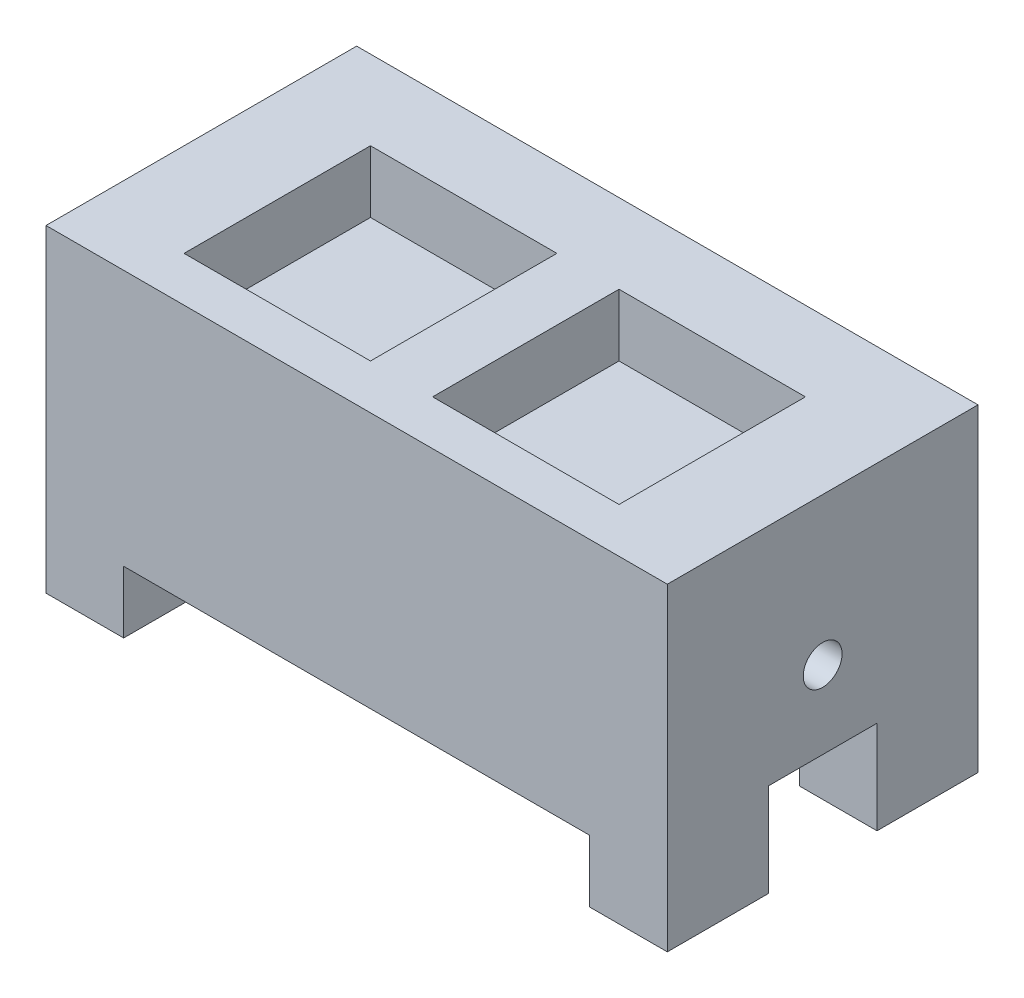
from build123d import *

# Parameters (mm, degrees)
EXTRUDE_1_DEPTH     = 40
SKETCH_2_R          = 2.5
SKETCH_2_W          = 14
SKETCH_2_H          = 12
CUT_EXTRUDE_1_DEPTH = 99.392072851
SKETCH_3_W          = 24
SKETCH_3_H          = 24
CUT_EXTRUDE_2_DEPTH = 8


with BuildPart() as part:
    # Эскиз1 → Бобышка-Вытянуть1 (new body)
    with BuildSketch(Plane.XY):
        Polygon((0, 0), (10, 0), (10, 8), (70, 8), (70, 0), (80, 0), (80, 41), (0, 41), align=None)
    extrude(amount=EXTRUDE_1_DEPTH)

    # Эскиз2 → Вырез-Вытянуть1 (cut, through all)
    with BuildSketch(Plane.ZY):
        with Locations((20, 22)):
            Circle(SKETCH_2_R)
        with Locations((20, 6)):
            Rectangle(SKETCH_2_W, SKETCH_2_H)
    extrude(amount=-CUT_EXTRUDE_1_DEPTH, mode=Mode.SUBTRACT)

    # Эскиз3 → Вырез-Вытянуть2 (cut)
    with BuildSketch(Plane(origin=(0, 41, 0), x_dir=(1, 0, 0), z_dir=(0, 1, 0))):
        with Locations((24, -22.220912541)):
            Rectangle(SKETCH_3_W, SKETCH_3_H)
        with Locations((56, -22.220912541)):
            Rectangle(SKETCH_3_W, SKETCH_3_H)
    extrude(amount=-CUT_EXTRUDE_2_DEPTH, mode=Mode.SUBTRACT)


solid = part.part
